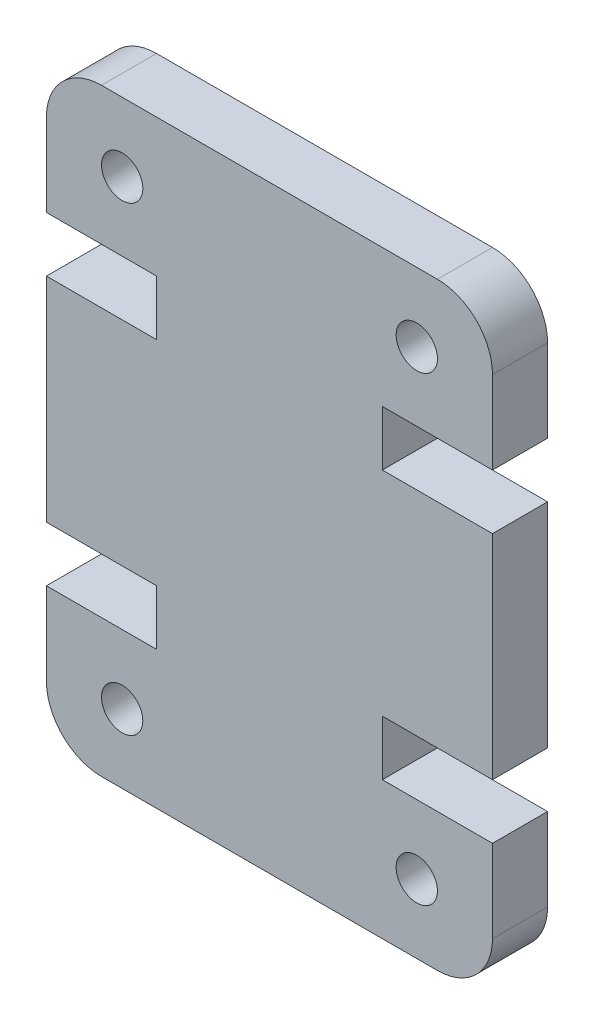
from build123d import *

# Parameters (mm, degrees)
SKETCH1_R           = 0.75
BOSS_EXTRUDE1_DEPTH = 2


with BuildPart() as part:
    # Sketch1 → Boss-Extrude1 (new body)
    with BuildSketch(Plane.XY):
        with BuildLine():
            Line((0, 14.74), (0, 7))
            Line((0, 7), (4, 7))
            Line((4, 7), (4, 5))
            Line((4, 5), (0, 5))
            Line((0, 5), (0, 2))
            ThreePointArc((0, 2), (0.585786438, 0.585786438), (2, 0))
            Line((2, 0), (14.2, 0))
            ThreePointArc((14.2, 0), (15.614213562, 0.585786438), (16.2, 2))
            Line((16.2, 2), (16.2, 5))
            Line((16.2, 5), (12.2, 5))
            Line((12.2, 5), (12.2, 7))
            Line((12.2, 7), (16.2, 7))
            Line((16.2, 7), (16.2, 14.74))
            Line((16.2, 14.74), (12.2, 14.74))
            Line((12.2, 14.74), (12.2, 16.74))
            Line((12.2, 16.74), (16.2, 16.74))
            Line((16.2, 16.74), (16.2, 19.74))
            ThreePointArc((16.2, 19.74), (15.614213562, 21.154213562), (14.2, 21.74))
            Line((14.2, 21.74), (2, 21.74))
            ThreePointArc((2, 21.74), (0.585786438, 21.154213562), (0, 19.74))
            Line((0, 19.74), (0, 16.74))
            Line((0, 16.74), (4, 16.74))
            Line((4, 16.74), (4, 14.74))
            Line((4, 14.74), (0, 14.74))
        make_face()
        with Locations(Location((13.45, 2.5, 0), (0, 0, 180))):
            Circle(SKETCH1_R, mode=Mode.SUBTRACT)
        with Locations(Location((2.75, 19.24, 0), (0, 0, 180))):
            Circle(SKETCH1_R, mode=Mode.SUBTRACT)
        with Locations((2.75, 2.5)):
            Circle(SKETCH1_R, mode=Mode.SUBTRACT)
        with Locations((13.45, 19.24)):
            Circle(SKETCH1_R, mode=Mode.SUBTRACT)
    extrude(amount=BOSS_EXTRUDE1_DEPTH)


solid = part.part
